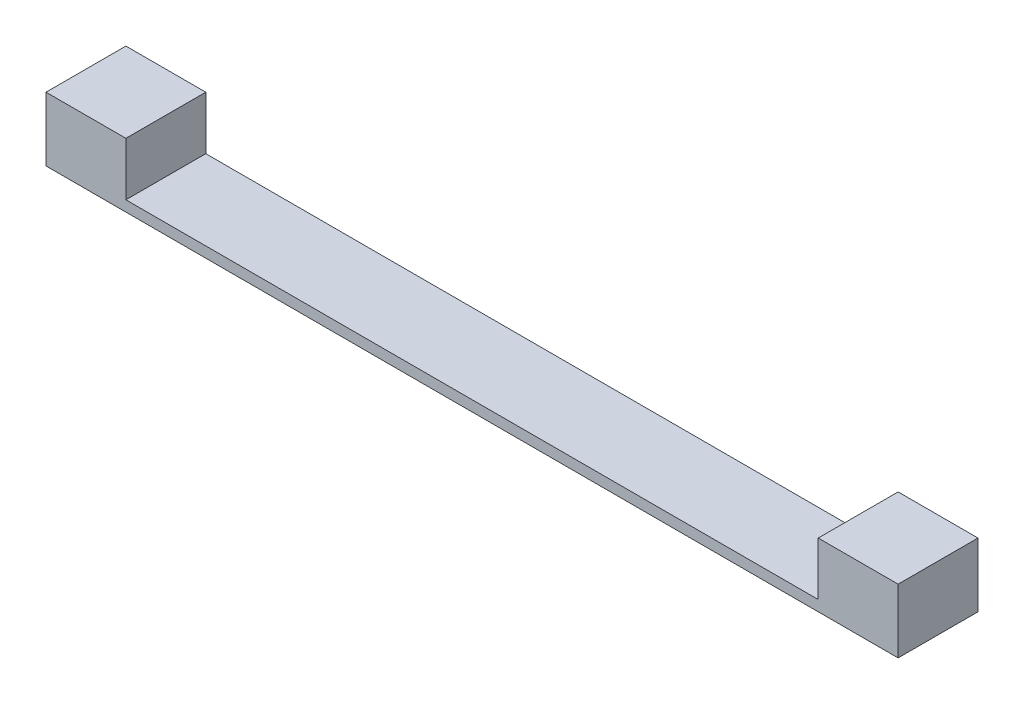
from build123d import *

# Parameters (mm, degrees)
SKETCH1_W           = 80
SKETCH1_H           = 7.5
BOSS_EXTRUDE1_DEPTH = 1
SKETCH2_W           = 7.5
SKETCH2_H           = 7.5
BOSS_EXTRUDE2_DEPTH = 5


with BuildPart() as part:
    # Sketch1 → Boss-Extrude1 (new body)
    with BuildSketch(Plane(origin=(0, 0, 0), x_dir=(1, 0, 0), z_dir=(0, 1, 0))):
        Rectangle(SKETCH1_W, SKETCH1_H)
    extrude(amount=BOSS_EXTRUDE1_DEPTH)

    # Sketch2 → Boss-Extrude2 (add)
    with BuildSketch(Plane(origin=(0, 1, 0), x_dir=(1, 0, 0), z_dir=(0, 1, 0))):
        with Locations((-36.25, 0)):
            Rectangle(SKETCH2_W, SKETCH2_H)
        with Locations((36.25, 0)):
            Rectangle(SKETCH2_W, SKETCH2_H)
    extrude(amount=BOSS_EXTRUDE2_DEPTH)


solid = part.part
